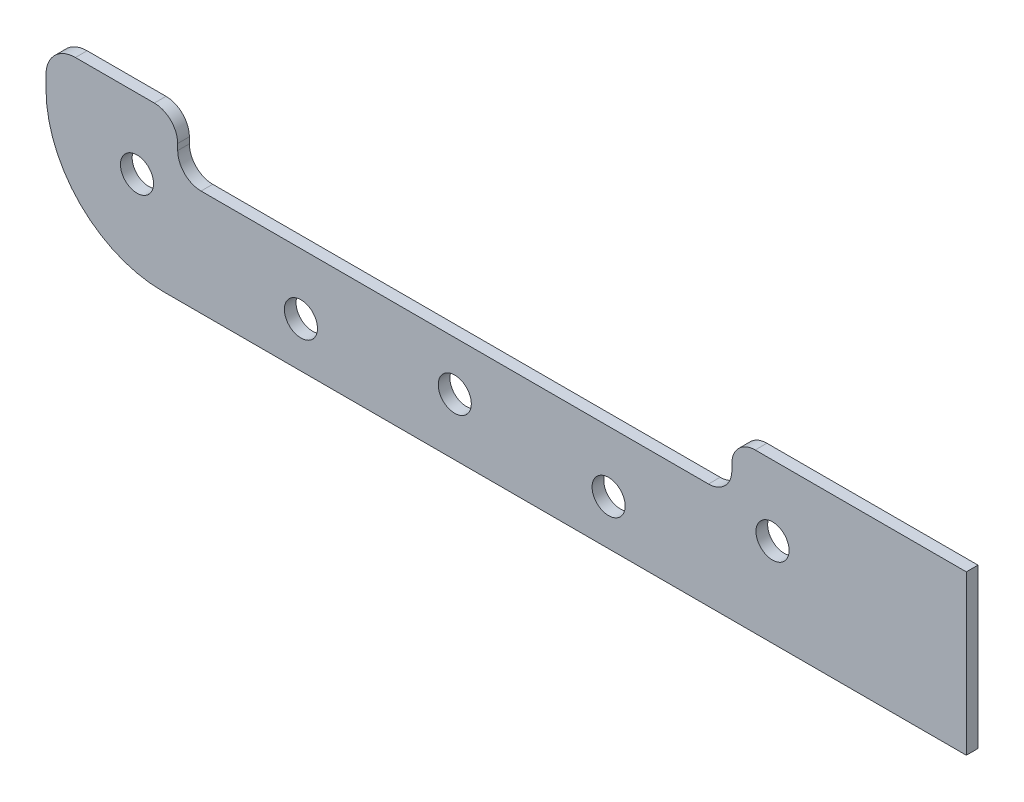
from build123d import *

# Parameters (mm, degrees)
SKETCH2_W                     = 111.125
SKETCH2_H                     = 193.04
BOSS_EXTRUDE1_DEPTH           = 1.5875
FILLET1_R                     = 15.875
SKETCH6_R                     = 2.4003
SKETCH6_R_2                   = 3
SKETCH6_R_3                   = 6.477
SKETCH6_R_4                   = 10.762
CUT_EXTRUDE1_DEPTH            = 212.192646736
SKETCH7_W                     = 13.97
SKETCH7_H                     = 193.04
BOSS_EXTRUDE2_DEPTH           = 1.5875
SKETCH8_W                     = 75.32443897
SKETCH8_H                     = 38.1
SKETCH8_R                     = 10.762
SKETCH8_R_2                   = 3
SKETCH8_H_2                   = 31.75
SKETCH8_H_3                   = 34.487219484
SKETCH8_R_3                   = 2.4003
SKETCH8_R_4                   = 6.477
SKETCH8_R_5                   = 8.9535
CUT_EXTRUDE2_DEPTH            = 1.5875
FILLET2_R                     = 9.525
FILLET4_R                     = 9.525
SKETCH9_W                     = 125.095
SKETCH9_H                     = 149.86
CUT_EXTRUDE5_DEPTH            = 80
FILLET6_R                     = 4
FILLET10_R                    = 4
SKETCH4_W                     = 2.25
SKETCH4_H                     = 1.5875
M4_CLEARANCE_HOLE1_AT_2_COUNT = 2
M4_CLEARANCE_HOLE1_AT_2_PITCH = 43.406709572
M4_CLEARANCE_HOLE1_AT_3_COUNT = 2
M4_CLEARANCE_HOLE1_AT_3_PITCH = 86.3827405
M4_CLEARANCE_HOLE1_AT_4_COUNT = 2
M4_CLEARANCE_HOLE1_AT_4_PITCH = 189.737314909
M4_CLEARANCE_HOLE1_AT_5_COUNT = 2
M4_CLEARANCE_HOLE1_AT_5_PITCH = 178.553711266
M4_CLEARANCE_HOLE1_AT_6_COUNT = 2
M4_CLEARANCE_HOLE1_AT_6_PITCH = 168.9327405
M4_CLEARANCE_HOLE1_AT_7_COUNT = 2
M4_CLEARANCE_HOLE1_AT_7_PITCH = 23.050611575
M4_CLEARANCE_HOLE1_AT_8_COUNT = 2
M4_CLEARANCE_HOLE1_AT_8_PITCH = 186.221930585
SKETCH12_R                    = 2.25
SKETCH12_W                    = 69.5325
SKETCH12_H                    = 21.59
CUT_EXTRUDE6_DEPTH            = 212.39048994
SKETCH13_W                    = 75.32443897
SKETCH13_H                    = 3.175
CUT_EXTRUDE7_DEPTH            = 70.847408973
FILLET11_R                    = 3.175


with BuildPart() as part:
    # Sketch2 → Boss-Extrude1 (new body)
    # profile 1 of 2: a face of its own
    with BuildSketch(Plane.XY.offset(-401.504104662)):
        with Locations((-6.650833159, 105.295051609)):
            Rectangle(SKETCH2_W, SKETCH2_H)
        with BuildLine():
            ThreePointArc((40.429624387, 185.872334563), (40.429624387, 193.650509156), (32.651449794, 193.650509156))
            Line((32.651449794, 193.650509156), (29.670992248, 190.670051609))
            Line((29.670992248, 190.670051609), (-1.150833159, 190.670051609))
            Line((-1.150833159, 190.670051609), (-1.150833159, 194.079751609))
            ThreePointArc((-1.150833159, 194.079751609), (-6.650833159, 199.579751609), (-12.150833159, 194.079751609))
            Line((-12.150833159, 194.079751609), (-12.150833159, 190.670051609))
            Line((-12.150833159, 190.670051609), (-42.972658566, 190.670051609))
            Line((-42.972658566, 190.670051609), (-45.953116112, 193.650509156))
            ThreePointArc((-45.953116112, 193.650509156), (-53.731290705, 193.650509156), (-53.731290705, 185.872334563))
            Line((-53.731290705, 185.872334563), (-50.750833159, 182.891877016))
            Line((-50.750833159, 182.891877016), (-50.750833159, 138.989051609))
            Line((-50.750833159, 138.989051609), (-54.160533159, 138.989051609))
            ThreePointArc((-54.160533159, 138.989051609), (-59.660533159, 133.489051609), (-54.160533159, 127.989051609))
            Line((-54.160533159, 127.989051609), (-50.750833159, 127.989051609))
            Line((-50.750833159, 127.989051609), (-50.750833159, 82.601051609))
            Line((-50.750833159, 82.601051609), (-54.160533159, 82.601051609))
            ThreePointArc((-54.160533159, 82.601051609), (-59.660533159, 77.101051609), (-54.160533159, 71.601051609))
            Line((-54.160533159, 71.601051609), (-50.750833159, 71.601051609))
            Line((-50.750833159, 71.601051609), (-50.750833159, 27.698226203))
            Line((-50.750833159, 27.698226203), (-53.731290705, 24.717768656))
            ThreePointArc((-53.731290705, 24.717768656), (-53.731290705, 16.939594063), (-45.953116112, 16.939594063))
            Line((-45.953116112, 16.939594063), (-42.972658566, 19.920051609))
            Line((-42.972658566, 19.920051609), (-12.150833159, 19.920051609))
            Line((-12.150833159, 19.920051609), (-12.150833159, 16.510351609))
            ThreePointArc((-12.150833159, 16.510351609), (-6.650833159, 11.010351609), (-1.150833159, 16.510351609))
            Line((-1.150833159, 16.510351609), (-1.150833159, 19.920051609))
            Line((-1.150833159, 19.920051609), (29.670992248, 19.920051609))
            Line((29.670992248, 19.920051609), (32.651449794, 16.939594063))
            ThreePointArc((32.651449794, 16.939594063), (40.429624387, 16.939594063), (40.429624387, 24.717768656))
            Line((40.429624387, 24.717768656), (37.449166841, 27.698226203))
            Line((37.449166841, 27.698226203), (37.449166841, 71.601051609))
            Line((37.449166841, 71.601051609), (40.858866841, 71.601051609))
            ThreePointArc((40.858866841, 71.601051609), (46.358866841, 77.101051609), (40.858866841, 82.601051609))
            Line((40.858866841, 82.601051609), (37.449166841, 82.601051609))
            Line((37.449166841, 82.601051609), (37.449166841, 127.989051609))
            Line((37.449166841, 127.989051609), (40.858866841, 127.989051609))
            ThreePointArc((40.858866841, 127.989051609), (46.358866841, 133.489051609), (40.858866841, 138.989051609))
            Line((40.858866841, 138.989051609), (37.449166841, 138.989051609))
            Line((37.449166841, 138.989051609), (37.449166841, 182.891877016))
            Line((37.449166841, 182.891877016), (40.429624387, 185.872334563))
        make_face(mode=Mode.SUBTRACT)
    # profile 2 of 2: a face of its own
    with BuildSketch(Plane.XY.offset(-401.504104662)):
        with BuildLine():
            Line((37.449166841, 182.891877016), (40.429624387, 185.872334563))
            ThreePointArc((40.429624387, 185.872334563), (40.429624387, 193.650509156), (32.651449794, 193.650509156))
            Line((32.651449794, 193.650509156), (29.670992248, 190.670051609))
            Line((29.670992248, 190.670051609), (-1.150833159, 190.670051609))
            Line((-1.150833159, 190.670051609), (-1.150833159, 194.079751609))
            ThreePointArc((-1.150833159, 194.079751609), (-6.650833159, 199.579751609), (-12.150833159, 194.079751609))
            Line((-12.150833159, 194.079751609), (-12.150833159, 190.670051609))
            Line((-12.150833159, 190.670051609), (-42.972658566, 190.670051609))
            Line((-42.972658566, 190.670051609), (-45.953116112, 193.650509156))
            ThreePointArc((-45.953116112, 193.650509156), (-53.731290705, 193.650509156), (-53.731290705, 185.872334563))
            Line((-53.731290705, 185.872334563), (-50.750833159, 182.891877016))
            Line((-50.750833159, 182.891877016), (-50.750833159, 138.989051609))
            Line((-50.750833159, 138.989051609), (-54.160533159, 138.989051609))
            ThreePointArc((-54.160533159, 138.989051609), (-59.660533159, 133.489051609), (-54.160533159, 127.989051609))
            Line((-54.160533159, 127.989051609), (-50.750833159, 127.989051609))
            Line((-50.750833159, 127.989051609), (-50.750833159, 82.601051609))
            Line((-50.750833159, 82.601051609), (-54.160533159, 82.601051609))
            ThreePointArc((-54.160533159, 82.601051609), (-59.660533159, 77.101051609), (-54.160533159, 71.601051609))
            Line((-54.160533159, 71.601051609), (-50.750833159, 71.601051609))
            Line((-50.750833159, 71.601051609), (-50.750833159, 27.698226203))
            Line((-50.750833159, 27.698226203), (-53.731290705, 24.717768656))
            ThreePointArc((-53.731290705, 24.717768656), (-53.731290705, 16.939594063), (-45.953116112, 16.939594063))
            Line((-45.953116112, 16.939594063), (-42.972658566, 19.920051609))
            Line((-42.972658566, 19.920051609), (-12.150833159, 19.920051609))
            Line((-12.150833159, 19.920051609), (-12.150833159, 16.510351609))
            ThreePointArc((-12.150833159, 16.510351609), (-6.650833159, 11.010351609), (-1.150833159, 16.510351609))
            Line((-1.150833159, 16.510351609), (-1.150833159, 19.920051609))
            Line((-1.150833159, 19.920051609), (29.670992248, 19.920051609))
            Line((29.670992248, 19.920051609), (32.651449794, 16.939594063))
            ThreePointArc((32.651449794, 16.939594063), (40.429624387, 16.939594063), (40.429624387, 24.717768656))
            Line((40.429624387, 24.717768656), (37.449166841, 27.698226203))
            Line((37.449166841, 27.698226203), (37.449166841, 71.601051609))
            Line((37.449166841, 71.601051609), (40.858866841, 71.601051609))
            ThreePointArc((40.858866841, 71.601051609), (46.358866841, 77.101051609), (40.858866841, 82.601051609))
            Line((40.858866841, 82.601051609), (37.449166841, 82.601051609))
            Line((37.449166841, 82.601051609), (37.449166841, 127.989051609))
            Line((37.449166841, 127.989051609), (40.858866841, 127.989051609))
            ThreePointArc((40.858866841, 127.989051609), (46.358866841, 133.489051609), (40.858866841, 138.989051609))
            Line((40.858866841, 138.989051609), (37.449166841, 138.989051609))
            Line((37.449166841, 138.989051609), (37.449166841, 182.891877016))
        make_face()
    extrude(amount=BOSS_EXTRUDE1_DEPTH)

    # Fillet1
    fillet1_edges = [part.edges().sort_by_distance(p)[0] for p in [
        (-62.213333159, 201.815051609, -400.710354662),
        (-62.213333159, 8.775051609, -400.710354662),
    ]]
    fillet(fillet1_edges, radius=FILLET1_R)

    # Sketch6 → Cut-Extrude1 (cut, through all)
    with BuildSketch(Plane.XY.offset(-399.916604662)):
        with Locations((-34.590833159, 43.382551609)):
            Circle(SKETCH6_R)
        with Locations((21.289166841, 43.382551609)):
            Circle(SKETCH6_R)
        with Locations((-20.884724927, 142.590766631)):
            Circle(SKETCH6_R_2)
        with Locations((7.583058609, 166.225175879)):
            Circle(SKETCH6_R_2)
        with Locations((3.509166841, 43.382551609)):
            Circle(SKETCH6_R_3)
        with Locations((-16.810833159, 43.382551609)):
            Circle(SKETCH6_R_3)
        with Locations((-33.320833159, 123.670051609)):
            Circle(SKETCH6_R_3)
        with Locations((-6.650833159, 154.407971255)):
            Circle(SKETCH6_R_4)
        with Locations((-6.650833159, 94.607131964)):
            Circle(SKETCH6_R_4)
    extrude(amount=-CUT_EXTRUDE1_DEPTH, mode=Mode.SUBTRACT)

    # Sketch7 → Boss-Extrude2 (add)
    with BuildSketch(Plane.XY.offset(-399.916604662)):
        with Locations((55.896666841, 105.295051609)):
            Rectangle(SKETCH7_W, SKETCH7_H)
    extrude(amount=-BOSS_EXTRUDE2_DEPTH)

    # Sketch8 → Cut-Extrude2 (cut)
    # profile 1 of 4: a face of its own
    with BuildSketch(Plane.XY.offset(-399.916604662)):
        with Locations((-6.650833159, 154.407971255)):
            Rectangle(SKETCH8_W, SKETCH8_H)
        with Locations((-6.650833159, 154.407971255)):
            Circle(SKETCH8_R, mode=Mode.SUBTRACT)
        with Locations((7.583058609, 166.225175879)):
            Circle(SKETCH8_R_2, mode=Mode.SUBTRACT)
        with Locations((-20.884724927, 142.590766631)):
            Circle(SKETCH8_R_2, mode=Mode.SUBTRACT)
    # profile 2 of 4: a face of its own
    with BuildSketch(Plane.XY.offset(-399.916604662)):
        with Locations((-6.650833159, 94.607131964)):
            Rectangle(SKETCH8_W, SKETCH8_H_2)
        with Locations((-6.650833159, 94.607131964)):
            Circle(SKETCH8_R, mode=Mode.SUBTRACT)
    # profile 3 of 4: a face of its own
    with BuildSketch(Plane.XY.offset(-399.916604662)):
        with Locations((-6.650833159, 43.601441867)):
            Rectangle(SKETCH8_W, SKETCH8_H_3)
        with Locations((-34.590833159, 43.382551609)):
            Circle(SKETCH8_R_3, mode=Mode.SUBTRACT)
        with Locations((-16.810833159, 43.382551609)):
            Circle(SKETCH8_R_4, mode=Mode.SUBTRACT)
        with Locations((3.509166841, 43.382551609)):
            Circle(SKETCH8_R_4, mode=Mode.SUBTRACT)
        with Locations((21.289166841, 43.382551609)):
            Circle(SKETCH8_R_3, mode=Mode.SUBTRACT)
    # profile 4 of 4: a face of its own
    with BuildSketch(Plane.XY.offset(-399.916604662)):
        with Locations((-33.320833159, 123.670051609)):
            Circle(SKETCH8_R_5)
        with Locations((-33.320833159, 123.670051609)):
            Circle(SKETCH8_R_4, mode=Mode.SUBTRACT)
    extrude(amount=-CUT_EXTRUDE2_DEPTH, mode=Mode.SUBTRACT)

    # Fillet2
    fillet2_edges = [part.edges().sort_by_distance(p)[0] for p in [
        (31.011386326, 135.357971255, -400.710354662),
        (-44.313052644, 135.357971255, -400.710354662),
        (-44.313052644, 173.457971255, -400.710354662),
        (31.011386326, 173.457971255, -400.710354662),
    ]]
    fillet(fillet2_edges, radius=FILLET2_R)

    # Fillet4
    fillet4_edges = [part.edges().sort_by_distance(p)[0] for p in [
        (31.011386326, 110.482131964, -400.710354662),
        (31.011386326, 78.732131964, -400.710354662),
        (-44.313052644, 78.732131964, -400.710354662),
        (-44.313052644, 110.482131964, -400.710354662),
    ]]
    fillet(fillet4_edges, radius=FILLET4_R)

    # Sketch9 → Cut-Extrude5 (cut)
    with BuildSketch(Plane.XY.offset(-399.916604662)):
        with Locations((0.334166841, 105.295051609)):
            Rectangle(SKETCH9_W, SKETCH9_H)
    extrude(amount=-CUT_EXTRUDE5_DEPTH, mode=Mode.SUBTRACT)


with BuildPart() as cut_extrude5_piece_1:
    # of the separate pieces the step leaves, piece 1, a body of its own (cut_extrude5_pieces)
    add(part.part.solids().sort_by_distance((62.881666841, 180.225051609, -401.504104662))[0])

    # Fillet10
    fillet10_edges = [cut_extrude5_piece_1.edges().sort_by_distance(p)[0] for p in [
        (-62.213333159, 180.225051609, -400.710354662),
    ]]
    fillet(fillet10_edges, radius=FILLET10_R)

    # Sketch4 → M4 Clearance Hole1 (revolve, cut)
    with BuildSketch(Plane(origin=(36.540537091, 189.761421859, -399.916604662), x_dir=(0, -1, 0), z_dir=(1, 0, 0))):
        with Locations((1.125, 0.79375)):
            Rectangle(SKETCH4_W, SKETCH4_H)
    m4_clearance_hole1 = revolve(axis=Axis((36.540537091, 189.761421859, -393.566604662), (0, 0, -1)), mode=Mode.SUBTRACT)

    # M4 Clearance Hole1 at 2: M4 Clearance Hole1 ×2
    with Locations(*[Vector(-0.9950390314183887, 0.09948530521617187, 0) * (i * M4_CLEARANCE_HOLE1_AT_2_PITCH) for i in range(1, M4_CLEARANCE_HOLE1_AT_2_COUNT)]):
        add(m4_clearance_hole1, mode=Mode.SUBTRACT)

    # M4 Clearance Hole1 at 3: M4 Clearance Hole1 ×2
    with Locations(*[(-i * M4_CLEARANCE_HOLE1_AT_3_PITCH, 0, 0) for i in range(1, M4_CLEARANCE_HOLE1_AT_3_COUNT)]):
        add(m4_clearance_hole1, mode=Mode.SUBTRACT)

    # M4 Clearance Hole1 at 7: M4 Clearance Hole1 ×2
    with Locations(*[Vector(-0.9665885641891935, 0.25633288430997997, 0) * (i * M4_CLEARANCE_HOLE1_AT_7_PITCH) for i in range(1, M4_CLEARANCE_HOLE1_AT_7_COUNT)]):
        add(m4_clearance_hole1, mode=Mode.SUBTRACT)


with BuildPart() as cut_extrude5_piece_2:
    # of the separate pieces the step leaves, piece 2, a body of its own (cut_extrude5_pieces)
    add(part.part.solids().sort_by_distance((-62.213333159, 24.650051609, -401.504104662))[0])

    # Fillet6
    fillet6_edges = [cut_extrude5_piece_2.edges().sort_by_distance(p)[0] for p in [
        (-62.213333159, 30.365051609, -400.710354662),
    ]]
    fillet(fillet6_edges, radius=FILLET6_R)

    # M4 Clearance Hole1 at 4: M4 Clearance Hole1 ×2
    with Locations(*[Vector(-0.45527544511186635, -0.890350643891603, 0) * (i * M4_CLEARANCE_HOLE1_AT_4_PITCH) for i in range(1, M4_CLEARANCE_HOLE1_AT_4_COUNT)]):
        add(m4_clearance_hole1, mode=Mode.SUBTRACT)

    # M4 Clearance Hole1 at 5: M4 Clearance Hole1 ×2
    with Locations(*[Vector(-0.24189567354056962, -0.970302263793275, 0) * (i * M4_CLEARANCE_HOLE1_AT_5_PITCH) for i in range(1, M4_CLEARANCE_HOLE1_AT_5_COUNT)]):
        add(m4_clearance_hole1, mode=Mode.SUBTRACT)

    # M4 Clearance Hole1 at 6: M4 Clearance Hole1 ×2
    with Locations(*[(0, -i * M4_CLEARANCE_HOLE1_AT_6_PITCH, 0) for i in range(1, M4_CLEARANCE_HOLE1_AT_6_COUNT)]):
        add(m4_clearance_hole1, mode=Mode.SUBTRACT)

    # M4 Clearance Hole1 at 8: M4 Clearance Hole1 ×2
    with Locations(*[Vector(-0.34422520887864616, -0.9388871101322313, 0) * (i * M4_CLEARANCE_HOLE1_AT_8_PITCH) for i in range(1, M4_CLEARANCE_HOLE1_AT_8_COUNT)]):
        add(m4_clearance_hole1, mode=Mode.SUBTRACT)


with BuildPart() as cut_extrude6_tool:
    # Sketch12 → Cut-Extrude6 (new, through all)
    # profile 1 of 5: a face of its own
    with BuildSketch(Plane.XY.offset(-399.916604662)):
        with BuildLine():
            Line((-6.650833159, 180.225051609), (-6.650833159, 201.815051609))
            Line((-6.650833159, 201.815051609), (-46.338333159, 201.815051609))
            ThreePointArc((-46.338333159, 201.815051609), (-57.56365331, 197.165371761), (-62.213333159, 185.940051609))
            Line((-62.213333159, 185.940051609), (-62.213333159, 184.225051609))
            ThreePointArc((-62.213333159, 184.225051609), (-61.041760284, 181.396624485), (-58.213333159, 180.225051609))
            Line((-58.213333159, 180.225051609), (-6.650833159, 180.225051609))
        make_face()
        with Locations((-27.561745863, 195.670051609)):
            Circle(SKETCH12_R, mode=Mode.SUBTRACT)
    # profile 2 of 5: a face of its own
    with BuildSketch(Plane.XY.offset(-399.916604662)):
        with Locations((-27.561745863, 195.670051609)):
            Circle(SKETCH12_R)
    # profile 3 of 5: a face of its own
    with BuildSketch(Plane.XY.offset(-399.916604662)):
        with Locations((28.115416841, 191.020051609)):
            Rectangle(SKETCH12_W, SKETCH12_H)
        with Locations((14.260079544, 195.670051609)):
            Circle(SKETCH12_R, mode=Mode.SUBTRACT)
    # profile 4 of 5: a face of its own
    with BuildSketch(Plane.XY.offset(-399.916604662)):
        with Locations((14.260079544, 195.670051609)):
            Circle(SKETCH12_R)
    # profile 5 of 5: a face of its own
    with BuildSketch(Plane.XY.offset(-399.916604662)):
        with Locations((14.260079544, 14.920051609)):
            Circle(SKETCH12_R)
    extrude(amount=-CUT_EXTRUDE6_DEPTH)


with BuildPart() as cut_extrude5_piece_1_1:
    add(cut_extrude5_piece_1.part)

    # Cut-Extrude6: cut by cut_extrude6_tool
    add(cut_extrude6_tool.part, mode=Mode.SUBTRACT)


with BuildPart() as cut_extrude5_piece_2_1:
    add(cut_extrude5_piece_2.part)

    # Cut-Extrude6: cut by cut_extrude6_tool
    add(cut_extrude6_tool.part, mode=Mode.SUBTRACT)

    # Sketch13 → Cut-Extrude7 (cut, through all)
    with BuildSketch(Plane.XY.offset(-399.916604662)):
        with Locations((-6.650833159, 24.770332125)):
            Rectangle(SKETCH13_W, SKETCH13_H)
    extrude(amount=-CUT_EXTRUDE7_DEPTH, mode=Mode.SUBTRACT)

    # Fillet11
    fillet11_edges = [cut_extrude5_piece_2_1.edges().sort_by_distance(p)[0] for p in [
        (-44.313052644, 30.365051609, -400.710354662),
        (31.011386326, 30.365051609, -400.710354662),
        (-44.313052644, 23.182832125, -400.710354662),
        (31.011386326, 23.182832125, -400.710354662),
    ]]
    fillet(fillet11_edges, radius=FILLET11_R)


solid = cut_extrude5_piece_2_1.part
